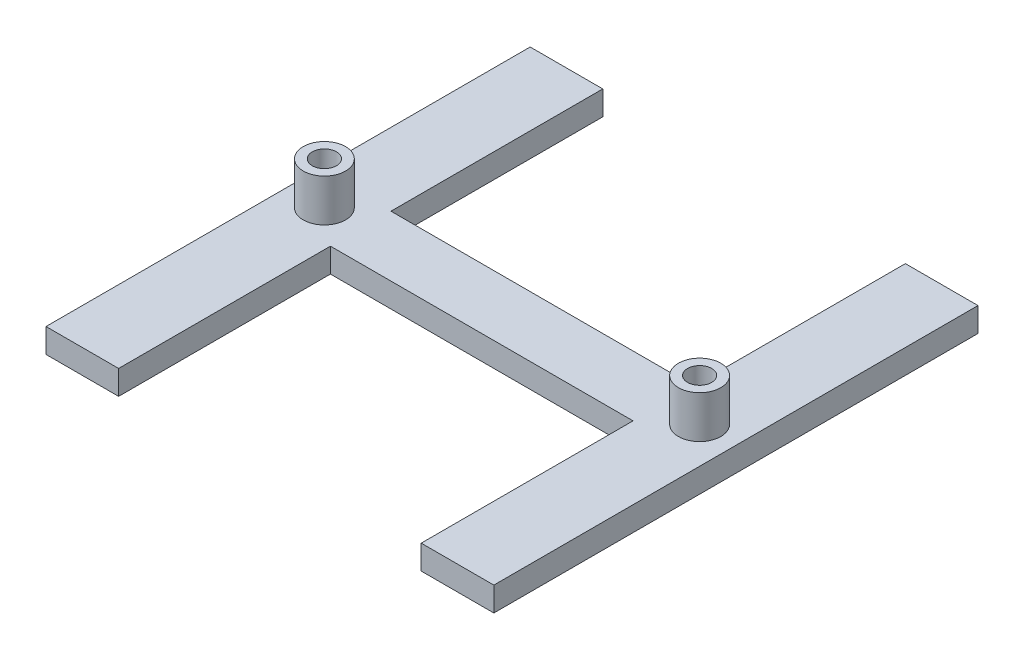
from build123d import *

# Parameters (mm, degrees)
SKETCH3_W           = 12
SKETCH3_H           = 80
SKETCH3_W_2         = 50
SKETCH3_H_2         = 10.001862112
BOSS_EXTRUDE1_DEPTH = 4
SKETCH4_R           = 3.5
SKETCH4_R_2         = 2
BOSS_EXTRUDE2_DEPTH = 7


with BuildPart() as part:
    # Sketch3 → Boss-Extrude1 (new body)
    with BuildSketch(Plane(origin=(0, 0, 0), x_dir=(1, 0, 0), z_dir=(0, 1, 0))):
        with Locations((-75.710799504, 83.763400912)):
            Rectangle(SKETCH3_W, SKETCH3_H)
        with Locations((-44.710799504, 83.763400912)):
            Rectangle(SKETCH3_W_2, SKETCH3_H_2)
        with Locations((-13.710799504, 83.763400912)):
            Rectangle(SKETCH3_W, SKETCH3_H)
    extrude(amount=BOSS_EXTRUDE1_DEPTH)

    # Sketch4 → Boss-Extrude2 (add)
    # profile 1 of 2: a face of its own
    with BuildSketch(Plane(origin=(0, 4, 0), x_dir=(1, 0, 0), z_dir=(0, 1, 0))):
        with Locations(Location((-75.710799504, 83.763400912, 0), (0, 0, 270))):
            Circle(SKETCH4_R)
        with Locations(Location((-75.710799504, 83.763400912, 0), (0, 0, 270))):
            Circle(SKETCH4_R_2, mode=Mode.SUBTRACT)
    # profile 2 of 2: a face of its own
    with BuildSketch(Plane(origin=(0, 4, 0), x_dir=(1, 0, 0), z_dir=(0, 1, 0))):
        with Locations(Location((-13.710799504, 83.763400912, 0), (0, 0, 270))):
            Circle(SKETCH4_R)
        with Locations(Location((-13.710799504, 83.763400912, 0), (0, 0, 270))):
            Circle(SKETCH4_R_2, mode=Mode.SUBTRACT)
    extrude(amount=BOSS_EXTRUDE2_DEPTH)


solid = part.part
